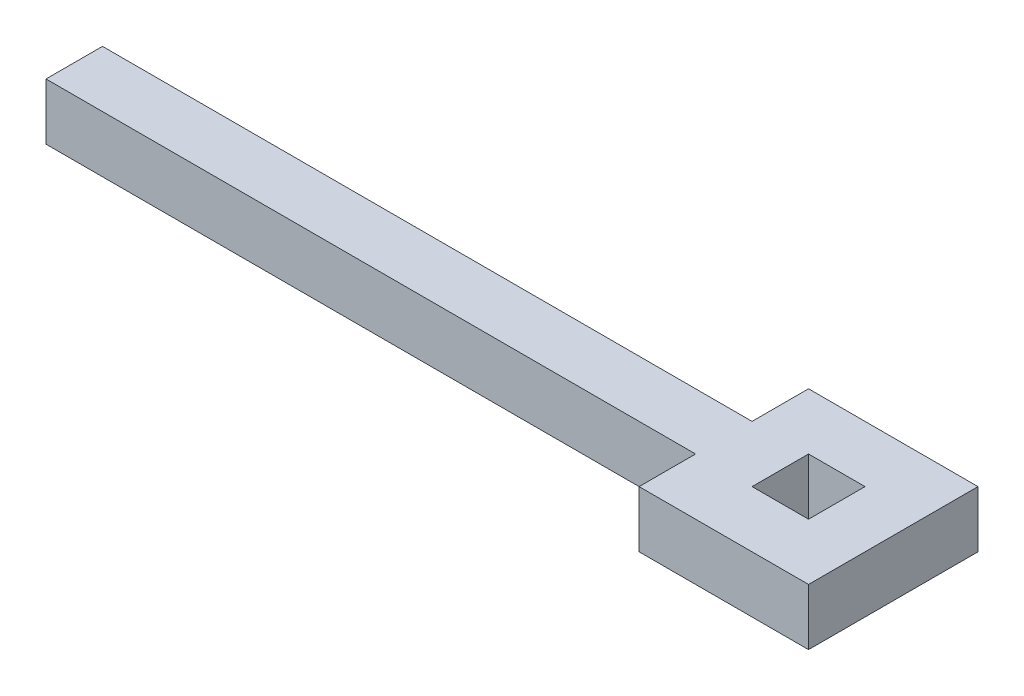
from build123d import *

# Parameters (mm, degrees)
SKETCH2_W           = 146.05
SKETCH2_H           = 12.7
BOSS_EXTRUDE1_DEPTH = 12.7
SKETCH3_W           = 38.1
SKETCH3_H           = 12.7
BOSS_EXTRUDE2_DEPTH = 38.1
SKETCH4_W           = 12.7
SKETCH4_H           = 12.7
CUT_EXTRUDE1_DEPTH  = 38.1


with BuildPart() as part:
    # Sketch2 → Boss-Extrude1 (new body)
    with BuildSketch(Plane(origin=(0, 0, 0), x_dir=(1, 0, 0), z_dir=(0, 1, 0))):
        with Locations((-73.025, 6.35)):
            Rectangle(SKETCH2_W, SKETCH2_H)
    extrude(amount=BOSS_EXTRUDE1_DEPTH)

    # Sketch3 → Boss-Extrude2 (add)
    with BuildSketch(Plane(origin=(0, 0, 0), x_dir=(0, 0, -1), z_dir=(1, 0, 0))):
        with Locations((6.35, 6.35)):
            Rectangle(SKETCH3_W, SKETCH3_H)
    extrude(amount=BOSS_EXTRUDE2_DEPTH)

    # Sketch4 → Cut-Extrude1 (cut)
    with BuildSketch(Plane(origin=(0, 12.7, 0), x_dir=(1, 0, 0), z_dir=(0, 1, 0))):
        with Locations((19.05, 6.35)):
            Rectangle(SKETCH4_W, SKETCH4_H)
    extrude(amount=-CUT_EXTRUDE1_DEPTH, mode=Mode.SUBTRACT)


solid = part.part
